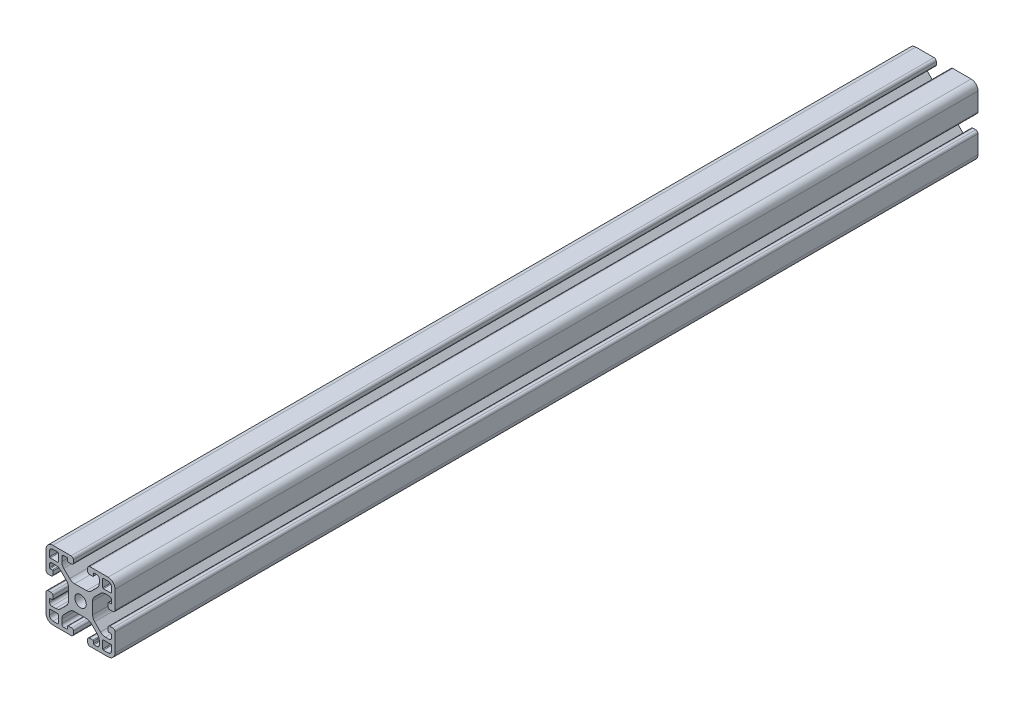
from build123d import *

# Parameters (mm, degrees)
ESQUISSE1_R        = 2.5
BOSS_EXTRU_1_DEPTH = 375


with BuildPart() as part:
    # Esquisse1 → Boss.-Extru.1 (new body)
    with BuildSketch(Plane.XY.offset(20)):
        with BuildLine():
            Line((20.3, 3), (18.9, 3))
            ThreePointArc((18.9, 3), (18.334314575, 2.765685425), (18.1, 2.2))
            Line((18.1, 2.2), (18.1, 1))
            ThreePointArc((18.1, 1), (18.392893219, 0.292893219), (19.1, 0))
            Line((19.1, 0), (27, 0))
            ThreePointArc((27, 0), (29.121320344, 0.878679656), (30, 3))
            Line((30, 3), (30, 10.9))
            ThreePointArc((30, 10.9), (29.707106781, 11.607106781), (29, 11.9))
            Line((29, 11.9), (27.8, 11.9))
            ThreePointArc((27.8, 11.9), (27.234314575, 11.665685425), (27, 11.1))
            Line((27, 11.1), (27, 9.7))
            ThreePointArc((27, 9.7), (27.087867966, 9.487867966), (27.3, 9.4))
            Line((27.3, 9.4), (28.2, 9.4))
            ThreePointArc((28.2, 9.4), (28.412132034, 9.312132034), (28.5, 9.1))
            Line((28.5, 9.1), (28.5, 7.85))
            ThreePointArc((28.5, 7.85), (28.207106781, 7.142893219), (27.5, 6.85))
            Line((27.5, 6.85), (25.806854249, 6.85))
            ThreePointArc((25.806854249, 6.85), (24.658803952, 7.078361402), (23.685533906, 7.728679656))
            Line((23.685533906, 7.728679656), (21.128679656, 10.285533906))
            ThreePointArc((21.128679656, 10.285533906), (20.478361402, 11.258803952), (20.25, 12.406854249))
            Line((20.25, 12.406854249), (20.25, 17.59314575))
            ThreePointArc((20.25, 17.59314575), (20.478361402, 18.741196048), (21.128679656, 19.714466094))
            Line((21.128679656, 19.714466094), (23.685533906, 22.271320344))
            ThreePointArc((23.685533906, 22.271320344), (24.658803952, 22.921638598), (25.80685425, 23.15))
            Line((25.80685425, 23.15), (27.5, 23.15))
            ThreePointArc((27.5, 23.15), (28.207106781, 22.857106781), (28.5, 22.15))
            Line((28.5, 22.15), (28.5, 20.9))
            ThreePointArc((28.5, 20.9), (28.412132034, 20.687867966), (28.2, 20.6))
            Line((28.2, 20.6), (27.3, 20.6))
            ThreePointArc((27.3, 20.6), (27.087867966, 20.512132034), (27, 20.3))
            Line((27, 20.3), (27, 18.9))
            ThreePointArc((27, 18.9), (27.234314575, 18.334314575), (27.8, 18.1))
            Line((27.8, 18.1), (29, 18.1))
            ThreePointArc((29, 18.1), (29.707106781, 18.392893219), (30, 19.1))
            Line((30, 19.1), (30, 27))
            ThreePointArc((30, 27), (29.121320344, 29.121320344), (27, 30))
            Line((27, 30), (19.1, 30))
            ThreePointArc((19.1, 30), (18.392893219, 29.707106781), (18.1, 29))
            Line((18.1, 29), (18.1, 27.8))
            ThreePointArc((18.1, 27.8), (18.334314575, 27.234314575), (18.9, 27))
            Line((18.9, 27), (20.3, 27))
            ThreePointArc((20.3, 27), (20.512132034, 27.087867966), (20.6, 27.3))
            Line((20.6, 27.3), (20.6, 28.2))
            ThreePointArc((20.6, 28.2), (20.687867966, 28.412132034), (20.9, 28.5))
            Line((20.9, 28.5), (22.15, 28.5))
            ThreePointArc((22.15, 28.5), (22.857106781, 28.207106781), (23.15, 27.5))
            Line((23.15, 27.5), (23.15, 25.806854249))
            ThreePointArc((23.15, 25.806854249), (22.921638598, 24.658803952), (22.271320344, 23.685533906))
            Line((22.271320344, 23.685533906), (19.714466094, 21.128679656))
            ThreePointArc((19.714466094, 21.128679656), (18.741196048, 20.478361402), (17.59314575, 20.25))
            Line((17.59314575, 20.25), (12.406854249, 20.25))
            ThreePointArc((12.406854249, 20.25), (11.258803952, 20.478361402), (10.285533906, 21.128679656))
            Line((10.285533906, 21.128679656), (7.728679656, 23.685533906))
            ThreePointArc((7.728679656, 23.685533906), (7.078361402, 24.658803952), (6.85, 25.806854249))
            Line((6.85, 25.806854249), (6.85, 27.5))
            ThreePointArc((6.85, 27.5), (7.142893219, 28.207106781), (7.85, 28.5))
            Line((7.85, 28.5), (9.1, 28.5))
            ThreePointArc((9.1, 28.5), (9.312132034, 28.412132034), (9.4, 28.2))
            Line((9.4, 28.2), (9.4, 27.3))
            ThreePointArc((9.4, 27.3), (9.487867966, 27.087867966), (9.7, 27))
            Line((9.7, 27), (11.1, 27))
            ThreePointArc((11.1, 27), (11.665685425, 27.234314575), (11.9, 27.8))
            Line((11.9, 27.8), (11.9, 29))
            ThreePointArc((11.9, 29), (11.607106781, 29.707106781), (10.9, 30))
            Line((10.9, 30), (3, 30))
            ThreePointArc((3, 30), (0.878679656, 29.121320344), (0, 27))
            Line((0, 27), (0, 19.1))
            ThreePointArc((0, 19.1), (0.292893219, 18.392893219), (1, 18.1))
            Line((1, 18.1), (2.2, 18.1))
            ThreePointArc((2.2, 18.1), (2.765685425, 18.334314575), (3, 18.9))
            Line((3, 18.9), (3, 20.3))
            ThreePointArc((3, 20.3), (2.912132034, 20.512132034), (2.7, 20.6))
            Line((2.7, 20.6), (1.8, 20.6))
            ThreePointArc((1.8, 20.6), (1.587867966, 20.687867966), (1.5, 20.9))
            Line((1.5, 20.9), (1.5, 22.15))
            ThreePointArc((1.5, 22.15), (1.792893219, 22.857106781), (2.5, 23.15))
            Line((2.5, 23.15), (4.19314575, 23.15))
            ThreePointArc((4.19314575, 23.15), (5.341196048, 22.921638598), (6.314466094, 22.271320344))
            Line((6.314466094, 22.271320344), (8.871320344, 19.714466094))
            ThreePointArc((8.871320344, 19.714466094), (9.521638598, 18.741196048), (9.75, 17.593145751))
            Line((9.75, 17.593145751), (9.75, 12.406854249))
            ThreePointArc((9.75, 12.406854249), (9.521638598, 11.258803952), (8.871320344, 10.285533906))
            Line((8.871320344, 10.285533906), (6.314466094, 7.728679656))
            ThreePointArc((6.314466094, 7.728679656), (5.341196048, 7.078361402), (4.19314575, 6.85))
            Line((4.19314575, 6.85), (2.5, 6.85))
            ThreePointArc((2.5, 6.85), (1.792893219, 7.142893219), (1.5, 7.85))
            Line((1.5, 7.85), (1.5, 9.1))
            ThreePointArc((1.5, 9.1), (1.587867966, 9.312132034), (1.8, 9.4))
            Line((1.8, 9.4), (2.7, 9.4))
            ThreePointArc((2.7, 9.4), (2.912132034, 9.487867966), (3, 9.7))
            Line((3, 9.7), (3, 11.1))
            ThreePointArc((3, 11.1), (2.765685425, 11.665685425), (2.2, 11.9))
            Line((2.2, 11.9), (1, 11.9))
            ThreePointArc((1, 11.9), (0.292893219, 11.607106781), (0, 10.9))
            Line((0, 10.9), (0, 3))
            ThreePointArc((0, 3), (0.878679656, 0.878679656), (3, 0))
            Line((3, 0), (10.9, 0))
            ThreePointArc((10.9, 0), (11.607106781, 0.292893219), (11.9, 1))
            Line((11.9, 1), (11.9, 2.2))
            ThreePointArc((11.9, 2.2), (11.665685425, 2.765685425), (11.1, 3))
            Line((11.1, 3), (9.7, 3))
            ThreePointArc((9.7, 3), (9.487867966, 2.912132034), (9.4, 2.7))
            Line((9.4, 2.7), (9.4, 1.8))
            ThreePointArc((9.4, 1.8), (9.312132034, 1.587867966), (9.1, 1.5))
            Line((9.1, 1.5), (7.85, 1.5))
            ThreePointArc((7.85, 1.5), (7.142893219, 1.792893219), (6.85, 2.5))
            Line((6.85, 2.5), (6.85, 4.19314575))
            ThreePointArc((6.85, 4.19314575), (7.078361402, 5.341196048), (7.728679656, 6.314466094))
            Line((7.728679656, 6.314466094), (10.285533906, 8.871320344))
            ThreePointArc((10.285533906, 8.871320344), (11.258803952, 9.521638598), (12.406854249, 9.75))
            Line((12.406854249, 9.75), (17.593145751, 9.75))
            ThreePointArc((17.593145751, 9.75), (18.741196048, 9.521638598), (19.714466094, 8.871320344))
            Line((19.714466094, 8.871320344), (22.271320344, 6.314466094))
            ThreePointArc((22.271320344, 6.314466094), (22.921638598, 5.341196048), (23.15, 4.193145751))
            Line((23.15, 4.193145751), (23.15, 2.5))
            ThreePointArc((23.15, 2.5), (22.857106781, 1.792893219), (22.15, 1.5))
            Line((22.15, 1.5), (20.9, 1.5))
            ThreePointArc((20.9, 1.5), (20.687867966, 1.587867966), (20.6, 1.8))
            Line((20.6, 1.8), (20.6, 2.7))
            ThreePointArc((20.6, 2.7), (20.512132034, 2.912132034), (20.3, 3))
        make_face()
        with Locations(Location((15, 15, 0), (0, 0, 180))):
            Circle(ESQUISSE1_R, mode=Mode.SUBTRACT)
        with BuildLine():
            Line((5.35, 5.05), (5.35, 1.8))
            ThreePointArc((5.35, 1.8), (5.262132034, 1.587867966), (5.05, 1.5))
            Line((5.05, 1.5), (3, 1.5))
            ThreePointArc((3, 1.5), (1.939339828, 1.939339828), (1.5, 3))
            Line((1.5, 3), (1.5, 5.05))
            ThreePointArc((1.5, 5.05), (1.587867966, 5.262132034), (1.8, 5.35))
            Line((1.8, 5.35), (5.05, 5.35))
            ThreePointArc((5.05, 5.35), (5.262132034, 5.262132034), (5.35, 5.05))
        make_face(mode=Mode.SUBTRACT)
        with BuildLine():
            Line((24.95, 5.35), (28.2, 5.35))
            ThreePointArc((28.2, 5.35), (28.412132034, 5.262132034), (28.5, 5.05))
            Line((28.5, 5.05), (28.5, 3))
            ThreePointArc((28.5, 3), (28.060660172, 1.939339828), (27, 1.5))
            Line((27, 1.5), (24.95, 1.5))
            ThreePointArc((24.95, 1.5), (24.737867966, 1.587867966), (24.65, 1.8))
            Line((24.65, 1.8), (24.65, 5.05))
            ThreePointArc((24.65, 5.05), (24.737867966, 5.262132034), (24.95, 5.35))
        make_face(mode=Mode.SUBTRACT)
        with BuildLine():
            Line((24.65, 24.95), (24.65, 28.2))
            ThreePointArc((24.65, 28.2), (24.737867966, 28.412132034), (24.95, 28.5))
            Line((24.95, 28.5), (27, 28.5))
            ThreePointArc((27, 28.5), (28.060660172, 28.060660172), (28.5, 27))
            Line((28.5, 27), (28.5, 24.95))
            ThreePointArc((28.5, 24.95), (28.412132034, 24.737867966), (28.2, 24.65))
            Line((28.2, 24.65), (24.95, 24.65))
            ThreePointArc((24.95, 24.65), (24.737867966, 24.737867966), (24.65, 24.95))
        make_face(mode=Mode.SUBTRACT)
        with BuildLine():
            Line((5.05, 24.65), (1.8, 24.65))
            ThreePointArc((1.8, 24.65), (1.587867966, 24.737867966), (1.5, 24.95))
            Line((1.5, 24.95), (1.5, 27))
            ThreePointArc((1.5, 27), (1.939339828, 28.060660172), (3, 28.5))
            Line((3, 28.5), (5.05, 28.5))
            ThreePointArc((5.05, 28.5), (5.262132034, 28.412132034), (5.35, 28.2))
            Line((5.35, 28.2), (5.35, 24.95))
            ThreePointArc((5.35, 24.95), (5.262132034, 24.737867966), (5.05, 24.65))
        make_face(mode=Mode.SUBTRACT)
    extrude(amount=-BOSS_EXTRU_1_DEPTH)


solid = part.part
